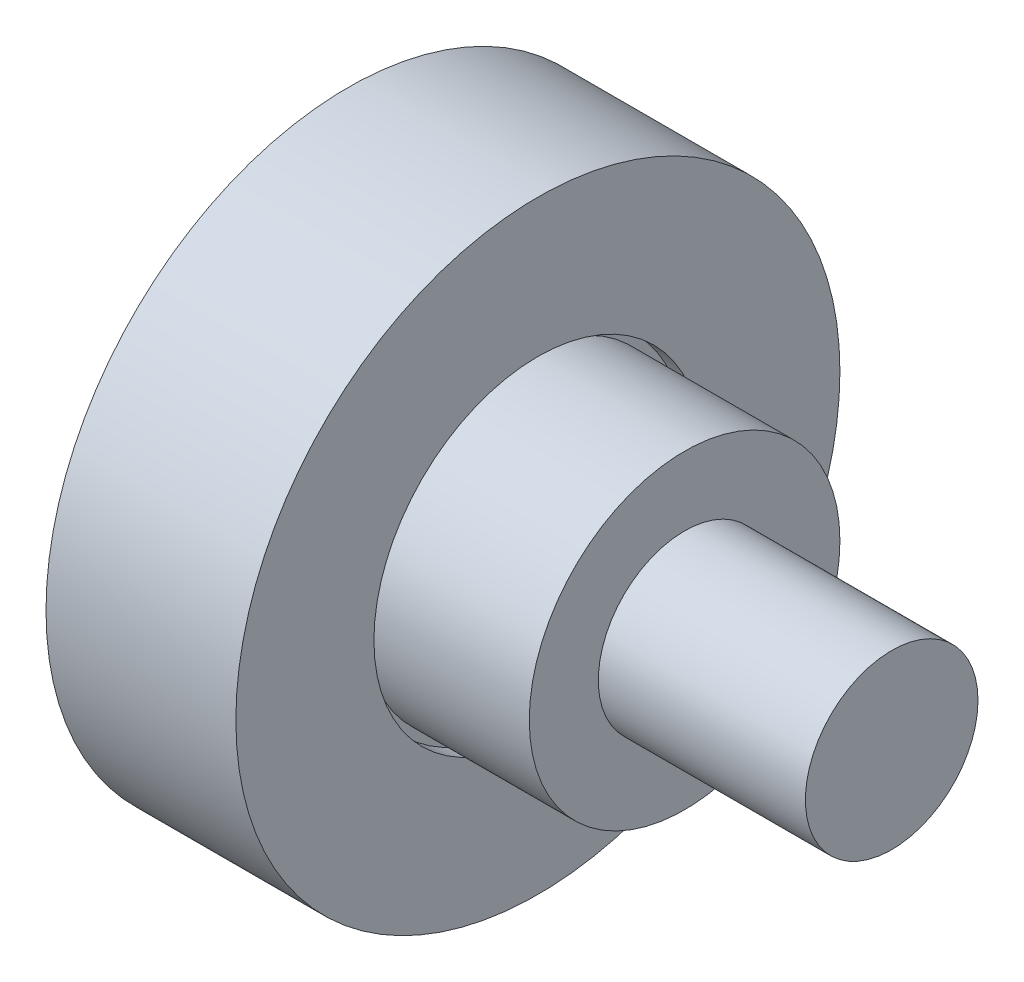
from build123d import *

# Parameters (mm, degrees)
SKETCH1_R           = 35
BOSS_EXTRUDE1_DEPTH = 22
SKETCH2_R           = 18
BOSS_EXTRUDE2_DEPTH = 17
SKETCH3_R           = 10
BOSS_EXTRUDE3_DEPTH = 24
CUT_EXTRUDE1_START  = -2
SKETCH4_R           = 19
SKETCH4_R_2         = 18
CUT_EXTRUDE1_DEPTH  = 2


with BuildPart() as part:
    # Sketch1 → Boss-Extrude1 (new body)
    with BuildSketch(Plane(origin=(0, 0, 0), x_dir=(0, 0, -1), z_dir=(1, 0, 0))):
        Circle(SKETCH1_R)
    extrude(amount=BOSS_EXTRUDE1_DEPTH)

    # Sketch2 → Boss-Extrude2 (add)
    with BuildSketch(Plane(origin=(22, 0, 0), x_dir=(0, 0, -1), z_dir=(1, 0, 0))):
        Circle(SKETCH2_R)
    extrude(amount=BOSS_EXTRUDE2_DEPTH)

    # Sketch3 → Boss-Extrude3 (add)
    with BuildSketch(Plane(origin=(39, 0, 0), x_dir=(0, 0, -1), z_dir=(1, 0, 0))):
        Circle(SKETCH3_R)
    extrude(amount=BOSS_EXTRUDE3_DEPTH)

    # Sketch4 → Cut-Extrude1 (cut)
    with BuildSketch(Plane(origin=(22, 0, 0), x_dir=(0, 0, -1), z_dir=(1, 0, 0)).offset(CUT_EXTRUDE1_START)):
        Circle(SKETCH4_R)
        Circle(SKETCH4_R_2, mode=Mode.SUBTRACT)
    extrude(amount=CUT_EXTRUDE1_DEPTH, mode=Mode.SUBTRACT)


solid = part.part
